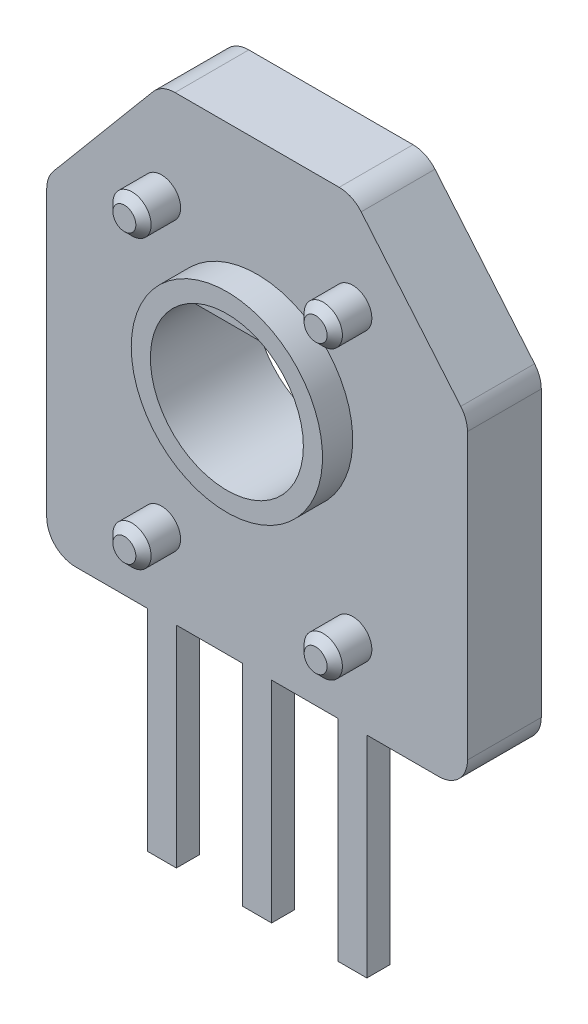
from build123d import *
from build123d.topology import SkipClean

# Parameters (mm, degrees)
BOSS_EXTRUDE1_DEPTH = 1.93
SKETCH2_R           = 2.5
SKETCH2_R_2         = 2
BOSS_EXTRUDE2_DEPTH = 0.79
FILLET2_R           = 0.75
SKETCH5_R           = 0.5
BOSS_EXTRUDE4_DEPTH = 0.97
CHAMFER1_SIZE       = 0.2
SKETCH6_W           = 0.76
SKETCH6_H           = 0.6
BOSS_EXTRUDE5_DEPTH = 5.5


with BuildPart() as part:
    # Sketch1 → Boss-Extrude1 (new body)
    with BuildSketch(Plane.XY):
        Polygon((5.5, 0), (5.5, -6.5), (-5.5, -6.5), (-5.5, 0), (-5.5, 1.96), (-2.49602332, 5.54), (2.49602332, 5.54), (5.5, 1.96), align=None)
        with BuildLine():
            Line((-1.718566554, 1.023), (1.718566554, 1.023))
            ThreePointArc((1.718566554, 1.023), (0, -2), (-1.718566554, 1.023))
        make_face(mode=Mode.SUBTRACT)
    extrude(amount=BOSS_EXTRUDE1_DEPTH)

    # Sketch2 → Boss-Extrude2 (add)
    with SkipClean():  # the faces are left unmerged after this step: merging them gives an invalid solid
        with BuildSketch(Plane.XY.offset(1.93)):
            with Locations(Location((0, 0, 0), (0, 0, 180))):
                Circle(SKETCH2_R)
            with Locations(Location((0, 0, 0), (0, 0, 149.236204264))):
                Circle(SKETCH2_R_2, mode=Mode.SUBTRACT)
        extrude(amount=BOSS_EXTRUDE2_DEPTH)

    # Fillet2
    fillet2_edges = [part.edges().sort_by_distance(p)[0] for p in [
        (5.5, -6.5, 0.965),
        (-5.5, -6.5, 0.965),
        (-5.5, 1.96, 0.965),
        (-2.49602332, 5.54, 0.965),
        (2.49602332, 5.54, 0.965),
        (5.5, 1.96, 0.965),
    ]]
    fillet(fillet2_edges, radius=FILLET2_R)

    # Sketch5 → Boss-Extrude4 (add)
    with SkipClean():  # the faces are left unmerged after this step: merging them gives an invalid solid
        with BuildSketch(Plane.XY.offset(1.93)):
            with Locations(Location((-2.5, -4.5, 0), (0, 0, 180))):
                Circle(SKETCH5_R)
            with Locations(Location((2.5, -4.5, 0), (0, 0, 180))):
                Circle(SKETCH5_R)
            with Locations(Location((2.5, 3, 0), (0, 0, 180))):
                Circle(SKETCH5_R)
            with Locations(Location((-2.5, 3, 0), (0, 0, 180))):
                Circle(SKETCH5_R)
        extrude(amount=BOSS_EXTRUDE4_DEPTH)

    # Chamfer1
    chamfer1_edges = [part.edges().sort_by_distance(p)[0] for p in [
        (3, -4.5, 2.9),
        (-2, -4.5, 2.9),
        (3, 3, 2.9),
        (-2, 3, 2.9),
    ]]
    chamfer(chamfer1_edges, length=CHAMFER1_SIZE)

    # Sketch6 → Boss-Extrude5 (add)
    with SkipClean():  # the faces are left unmerged after this step: merging them gives an invalid solid
        with BuildSketch(Plane.XZ.offset(6.5)):
            with Locations((-2.49, 1.63)):
                Rectangle(SKETCH6_W, SKETCH6_H)
            with Locations((0, 1.63)):
                Rectangle(SKETCH6_W, SKETCH6_H)
            with Locations((2.49, 1.63)):
                Rectangle(SKETCH6_W, SKETCH6_H)
        extrude(amount=BOSS_EXTRUDE5_DEPTH)


solid = part.part
